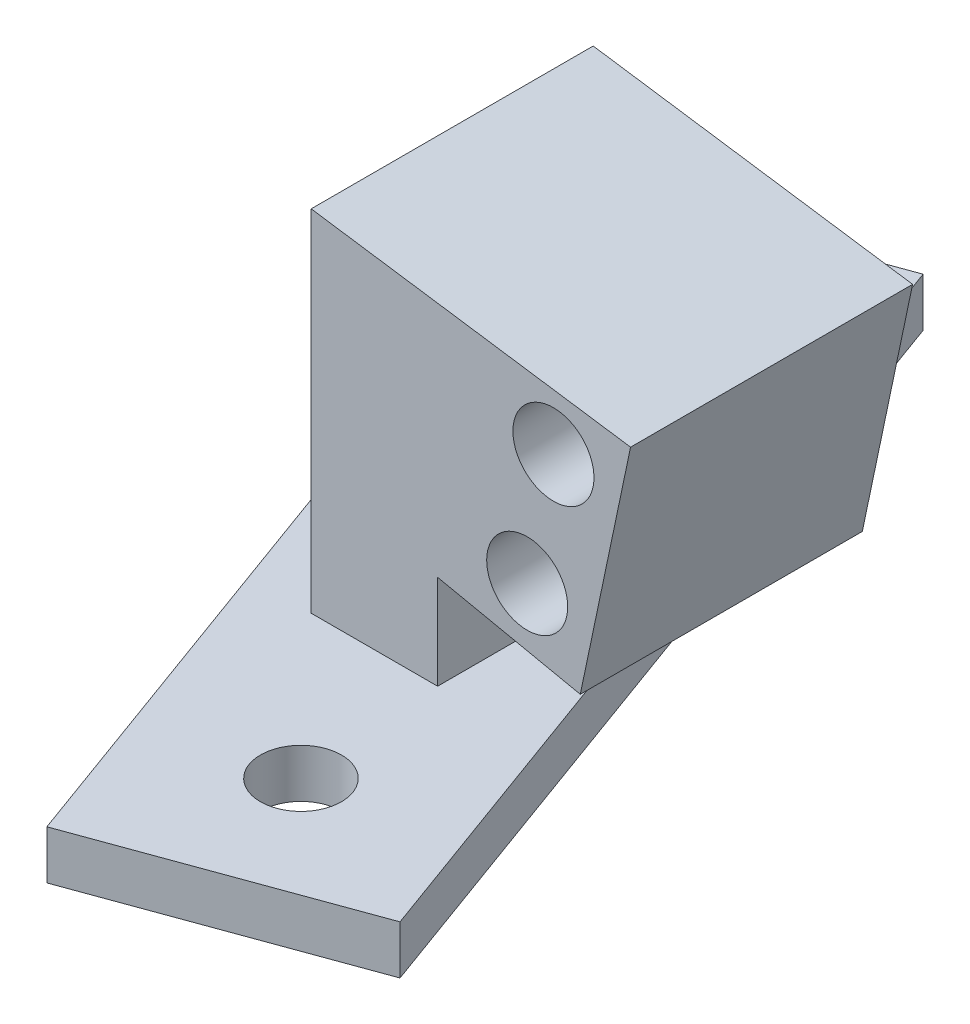
from build123d import *

# Parameters (mm, degrees)
SKETCH1_R            = 3.175
BOSS_EXTRUDE1_DEPTH  = 22.098
SKETCH2_W            = 6.364573253
SKETCH2_H            = 22.098
BOSS_EXTRUDE2_DEPTH  = 8.89
SKETCH12_R           = 3.175
BOSS_EXTRUDE6_DEPTH  = 3.81
BOSS_EXTRUDE12_DEPTH = 22.098
CUT_EXTRUDE1_DEPTH   = 35.052
BOSS_EXTRUDE13_DEPTH = 22.098


with BuildPart() as part:
    # Sketch1 → Boss-Extrude1 (new body)
    with BuildSketch(Plane.XY):
        Polygon((-629.011320926, 228.514758378), (-646.417262265, 232.174381811), (-650.357758597, 213.432549691), (-632.951817258, 209.772926258), align=None)
        with Locations(Location((-635.053635704, 225, 0), (0, 0, 180))):
            Circle(SKETCH1_R, mode=Mode.SUBTRACT)
        with Locations(Location((-637.11116423, 215.213960129, 0), (0, 0, 180))):
            Circle(SKETCH1_R, mode=Mode.SUBTRACT)
    extrude(amount=BOSS_EXTRUDE1_DEPTH)

    # Sketch2 → Boss-Extrude2 (add)
    with BuildSketch(Plane(origin=(15.442364745, 73.44714554, 0), x_dir=(0.9786039871389689, -0.20575285260650125, 0), z_dir=(-0.20575285260650128, -0.978603987138969, 0))):
        with Locations((-677.174764942, 11.049)):
            Rectangle(SKETCH2_W, SKETCH2_H)
    extrude(amount=BOSS_EXTRUDE2_DEPTH)

    # Sketch12 → Boss-Extrude6 (add)
    with BuildSketch(Plane(origin=(0, 204.732760245, 0), x_dir=(1, 0, 0), z_dir=(0, 1, 0))):
        Polygon((-673.35674497, 17.499509084), (-649.901003541, -46.94461085), (-629.613039858, -39.560395955), (-653.068781287, 24.883723978), align=None)
        with Locations(Location((-659.737838472, 11.644339504, 0), (0, 0, 270))):
            Circle(SKETCH12_R, mode=Mode.SUBTRACT)
        with Locations(Location((-643.231946355, -33.705226375, 0), (0, 0, 270))):
            Circle(SKETCH12_R, mode=Mode.SUBTRACT)
    extrude(amount=-BOSS_EXTRUDE6_DEPTH)

    # Sketch19 → Boss-Extrude12 (add)
    with BuildSketch(Plane.XY.offset(22.098)):
        Polygon((-646.417262265, 232.174381811), (-654.037262265, 232.174381811), (-654.037262265, 204.732760245), (-652.186901457, 204.732760245), align=None)
    extrude(amount=-BOSS_EXTRUDE12_DEPTH)

    # Sketch20 → Cut-Extrude1 (cut)
    with BuildSketch(Plane(origin=(0, 0, 0), x_dir=(-1, 0, 0), z_dir=(0, 0, -1))):
        Polygon((629.011320926, 228.514758378), (654.037262265, 232.174381811), (646.417262265, 232.174381811), align=None)
    extrude(amount=-CUT_EXTRUDE1_DEPTH, mode=Mode.SUBTRACT)

    # Sketch21 → Boss-Extrude13 (add)
    with BuildSketch(Plane(origin=(0, 0, 0), x_dir=(-1, 0, 0), z_dir=(0, 0, -1))):
        Polygon((644.129361835, 212.123020588), (644.129361835, 204.732760245), (645.683174376, 204.732760245), align=None)
    extrude(amount=-BOSS_EXTRUDE13_DEPTH)


solid = part.part
